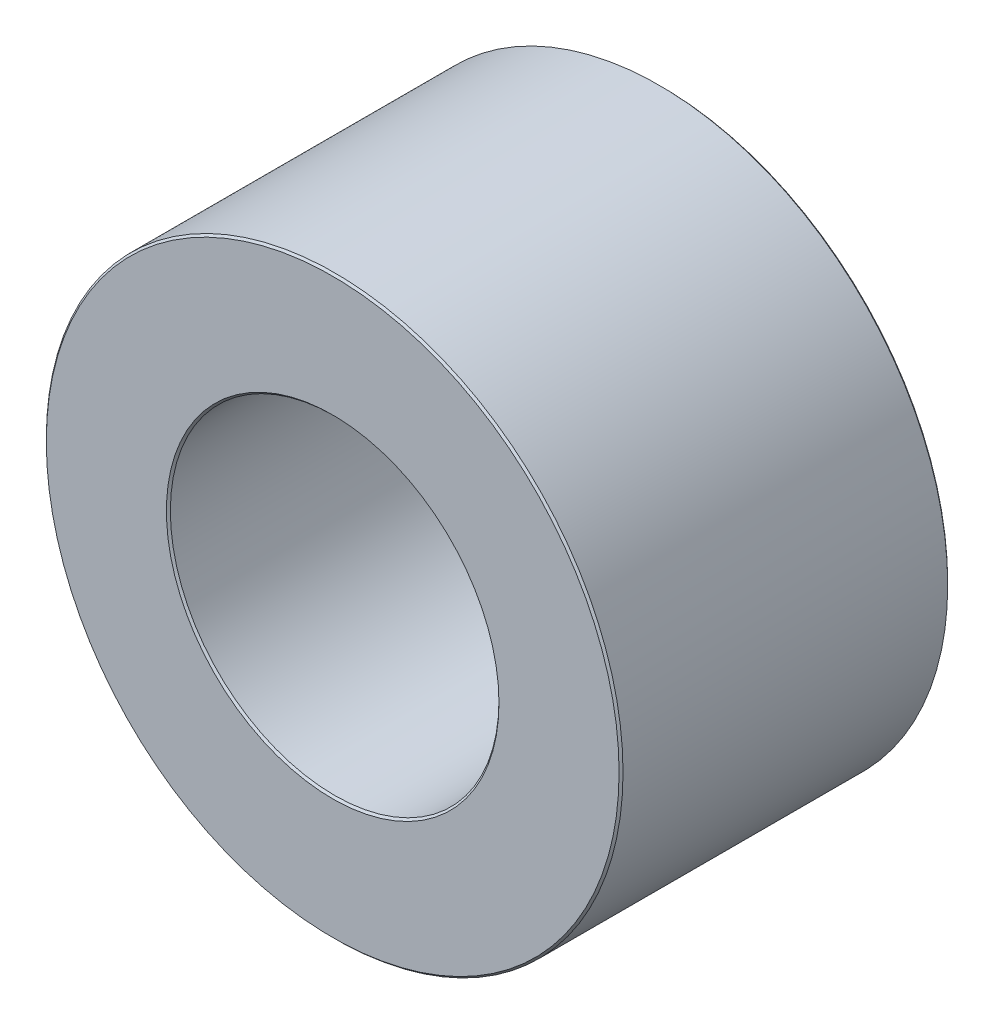
from build123d import *

# Parameters (mm, degrees)
BOSS_EXTRUDE1_DEPTH      = 2
BOSS_EXTRUDE1_DEPTH_BACK = 2
SKETCH5_R                = 3.51
SKETCH5_R_2              = 2
CHAMFER1_SIZE            = 0.024


with BuildPart() as part:
    # Sketch5 → Boss-Extrude1 (new, two sides: drawn at the far end of the back side and taken through both)
    with BuildSketch(Plane.XY.offset(-BOSS_EXTRUDE1_DEPTH_BACK)):
        Circle(SKETCH5_R)
        Circle(SKETCH5_R_2, mode=Mode.SUBTRACT)
    extrude(amount=BOSS_EXTRUDE1_DEPTH + BOSS_EXTRUDE1_DEPTH_BACK)

    # Chamfer1
    chamfer1_edges = [part.edges().sort_by_distance(p)[0] for p in [
        (-3.51, 0, 2),
        (-2, 0, 2),
        (-3.51, 0, -2),
        (-2, 0, -2),
    ]]
    chamfer(chamfer1_edges, length=CHAMFER1_SIZE)


solid = part.part
